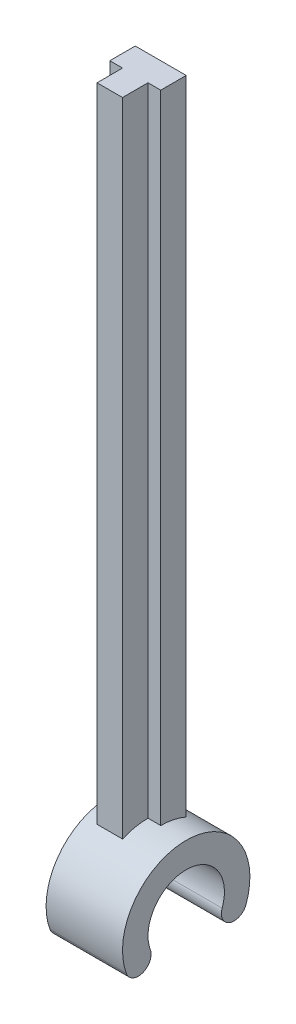
from build123d import *

# Parameters (mm, degrees)
BOSS_EXTRUDE1_DEPTH      = 4
BOSS_EXTRUDE1_DEPTH_BACK = 2
BOSS_EXTRUDE2_DEPTH      = 2
BOSS_EXTRUDE2_DEPTH_BACK = 2
BOSS_EXTRUDE3_DEPTH      = 1
BOSS_EXTRUDE3_DEPTH_BACK = 1
SKETCH3_W                = 2
SKETCH3_H                = 52


with BuildPart() as part:
    # Sketch1 → Boss-Extrude1 (new, two sides: drawn at the far end of the back side and taken through both)
    with BuildSketch(Plane(origin=(0, 0, 0), x_dir=(0, 0, -1), z_dir=(1, 0, 0)).offset(-BOSS_EXTRUDE1_DEPTH_BACK)):
        with BuildLine():
            ThreePointArc((-2.819077862, -1.02606043), (0, 3), (2.819077862, -1.02606043))
            ThreePointArc((2.819077862, -1.02606043), (3.41675034, -2.307773194), (4.698463104, -1.710100717))
            ThreePointArc((4.698463104, -1.710100717), (0, 5), (-4.698463104, -1.710100717))
            ThreePointArc((-4.698463104, -1.710100717), (-3.41675034, -2.307773194), (-2.819077862, -1.02606043))
        make_face()
    extrude(amount=BOSS_EXTRUDE1_DEPTH + BOSS_EXTRUDE1_DEPTH_BACK)

    # Sketch2 → Boss-Extrude2 (add, two sides: drawn at the far end of the back side and taken through both)
    with BuildSketch(Plane(origin=(0, 0, 0), x_dir=(0, 0, -1), z_dir=(1, 0, 0)).offset(-BOSS_EXTRUDE2_DEPTH_BACK)):
        Polygon((0, 5), (0, 3), (2, 3), (2, 55), (0, 55), align=None)
    extrude(amount=BOSS_EXTRUDE2_DEPTH + BOSS_EXTRUDE2_DEPTH_BACK)

    # Sketch3 → Boss-Extrude3 (add, two sides: drawn at the far end of the back side and taken through both)
    with BuildSketch(Plane(origin=(0, 0, 0), x_dir=(0, 0, -1), z_dir=(1, 0, 0)).offset(-BOSS_EXTRUDE3_DEPTH_BACK)):
        with Locations((-1, 29)):
            Rectangle(SKETCH3_W, SKETCH3_H)
    extrude(amount=BOSS_EXTRUDE3_DEPTH + BOSS_EXTRUDE3_DEPTH_BACK)


solid = part.part
